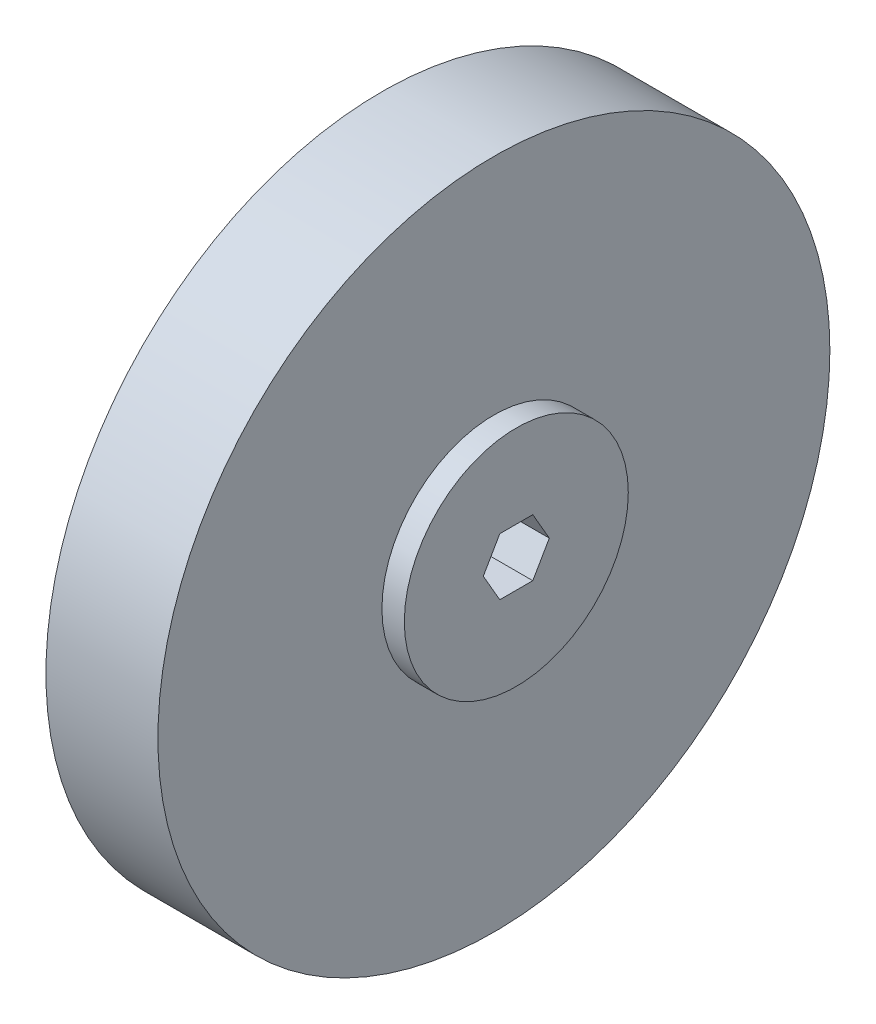
from build123d import *

# Parameters (mm, degrees)
SKETCH_3_R          = 75
EXTRUDE_1_DEPTH     = 25
SKETCH_4_R          = 25
EXTRUDE_3_DEPTH     = 5
EXTRUDE_START       = 5
SKETCH_6_R          = 25
EXTRUDE_4_DEPTH     = 5
CUT_EXTRUDE_3_DEPTH = 40


with BuildPart() as part:
    # 草图3 → 凸台-拉伸1 (new body)
    with BuildSketch(Plane(origin=(0, 0, 0), x_dir=(0, 0, -1), z_dir=(1, 0, 0))):
        Circle(SKETCH_3_R)
    extrude(amount=EXTRUDE_1_DEPTH)

    # 草图4 → 凸台-拉伸3 (add)
    with BuildSketch(Plane(origin=(25, 0, 0), x_dir=(0, 0, -1), z_dir=(1, 0, 0))):
        Circle(SKETCH_4_R)
    extrude(amount=EXTRUDE_3_DEPTH)

    # 草图6 → 凸台-拉伸4 (add)
    with BuildSketch(Plane.ZY.offset(EXTRUDE_START)):
        with Locations(Location((0, 0, 0), (0, 0, 180))):
            Circle(SKETCH_6_R)
    extrude(amount=-EXTRUDE_4_DEPTH)

    # 草图7 → 切除-拉伸3 (cut)
    with BuildSketch(Plane(origin=(30, 0, 0), x_dir=(0, 0, -1), z_dir=(1, 0, 0))):
        Polygon((7.366989435, 0), (3.683494717, 6.38), (-3.683494717, 6.38), (-7.366989435, 0), (-3.683494717, -6.38), (3.683494717, -6.38), align=None)
    extrude(amount=-CUT_EXTRUDE_3_DEPTH, mode=Mode.SUBTRACT)


solid = part.part
